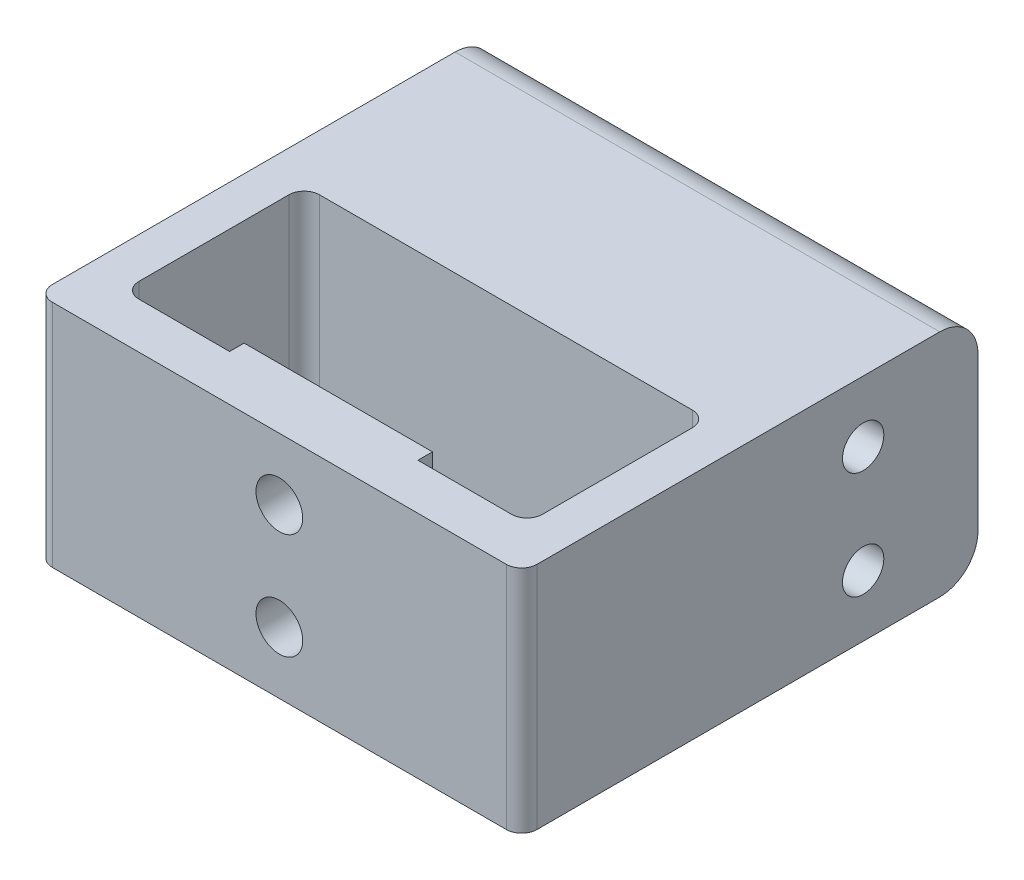
from build123d import *

# Parameters (mm, degrees)
ESQUISSE1_W             = 24.6
ESQUISSE1_H             = 30
BOSS_EXTRU_1_DEPTH      = 1.9
ESQUISSE2_W             = 52.7
ESQUISSE2_H             = 30
BOSS_EXTRU_2_DEPTH      = 6
ESQUISSE4_W             = 29.6
ESQUISSE4_H             = 30
BOSS_EXTRU_3_DEPTH      = 5.3
ESQUISSE5_W             = 29.6
ESQUISSE5_H             = 30
BOSS_EXTRU_4_DEPTH      = 5.3
ESQUISSE6_W             = 63.3
ESQUISSE6_H             = 30
BOSS_EXTRU_5_DEPTH      = 3
CONG_1_R                = 2
ESQUISSE7_W             = 63.3
ESQUISSE7_H             = 30
BOSS_EXTRU_6_DEPTH      = 27
CONG_3_R                = 5
ESQUISSE3_R             = 3.05
ENL_V_MAT_EXTRU_2_DEPTH = 26
ESQUISSE8_R             = 2.7
ENL_V_MAT_EXTRU_3_DEPTH = 68


with BuildPart() as part:
    # Esquisse1 → Boss.-Extru.1 (new body)
    with BuildSketch(Plane.XY):
        with Locations((-0.2, -1.155063291)):
            Rectangle(ESQUISSE1_W, ESQUISSE1_H)
    extrude(amount=BOSS_EXTRU_1_DEPTH)

    # Esquisse2 → Boss.-Extru.2 (add)
    with BuildSketch(Plane.XY.offset(1.9)):
        with Locations((0, -1.155063291)):
            Rectangle(ESQUISSE2_W, ESQUISSE2_H)
    extrude(amount=BOSS_EXTRU_2_DEPTH)

    # Esquisse4 → Boss.-Extru.3 (add)
    with BuildSketch(Plane.ZY.offset(26.35)):
        with Locations((-6.9, -1.155063291)):
            Rectangle(ESQUISSE4_W, ESQUISSE4_H)
    extrude(amount=BOSS_EXTRU_3_DEPTH)

    # Esquisse5 → Boss.-Extru.4 (add)
    with BuildSketch(Plane(origin=(26.35, 0, 0), x_dir=(0, 0, -1), z_dir=(1, 0, 0))):
        with Locations((6.9, -1.155063291)):
            Rectangle(ESQUISSE5_W, ESQUISSE5_H)
    extrude(amount=BOSS_EXTRU_4_DEPTH)

    # Esquisse6 → Boss.-Extru.5 (add)
    with BuildSketch(Plane(origin=(0, 0, -21.7), x_dir=(-1, 0, 0), z_dir=(0, 0, -1))):
        with Locations((0, -1.155063291)):
            Rectangle(ESQUISSE6_W, ESQUISSE6_H)
    extrude(amount=BOSS_EXTRU_5_DEPTH)

    # Congé1
    cong_1_edges = [part.edges().sort_by_distance(p)[0] for p in [
        (-26.35, -1.155063291, 1.9),
        (26.35, -1.155063291, 1.9),
        (-26.35, -1.155063291, -21.7),
        (-31.65, -1.155063291, 7.9),
        (26.35, -1.155063291, -21.7),
        (31.65, -1.155063291, 7.9),
    ]]
    fillet(cong_1_edges, radius=CONG_1_R)

    # Esquisse7 → Boss.-Extru.6 (add)
    with BuildSketch(Plane(origin=(0, 0, -24.7), x_dir=(-1, 0, 0), z_dir=(0, 0, -1))):
        with Locations((0, -1.155063291)):
            Rectangle(ESQUISSE7_W, ESQUISSE7_H)
    extrude(amount=BOSS_EXTRU_6_DEPTH)

    # Congé3
    cong_3_edges = [part.edges().sort_by_distance(p)[0] for p in [
        (0, -16.155063291, -51.7),
        (0, 13.844936709, -51.7),
    ]]
    fillet(cong_3_edges, radius=CONG_3_R)

    # Esquisse3 → Enlèv. mat.-Extru.2 (cut)
    with BuildSketch(Plane.XY):
        with Locations(Location((0, 5.769936709, 0), (0, 0, 180))):
            Circle(ESQUISSE3_R)
        with Locations(Location((0, -8.080063291, 0), (0, 0, 180))):
            Circle(ESQUISSE3_R)
    extrude(amount=ENL_V_MAT_EXTRU_2_DEPTH, mode=Mode.SUBTRACT)

    # Esquisse8 → Enlèv. mat.-Extru.3 (cut)
    with BuildSketch(Plane.ZY.offset(31.65)):
        with Locations(Location((-36.7, 5.844936709, 0), (0, 0, 270))):
            Circle(ESQUISSE8_R)
        with Locations(Location((-36.7, -8.155063291, 0), (0, 0, 270))):
            Circle(ESQUISSE8_R)
    extrude(amount=-ENL_V_MAT_EXTRU_3_DEPTH, mode=Mode.SUBTRACT)


solid = part.part
